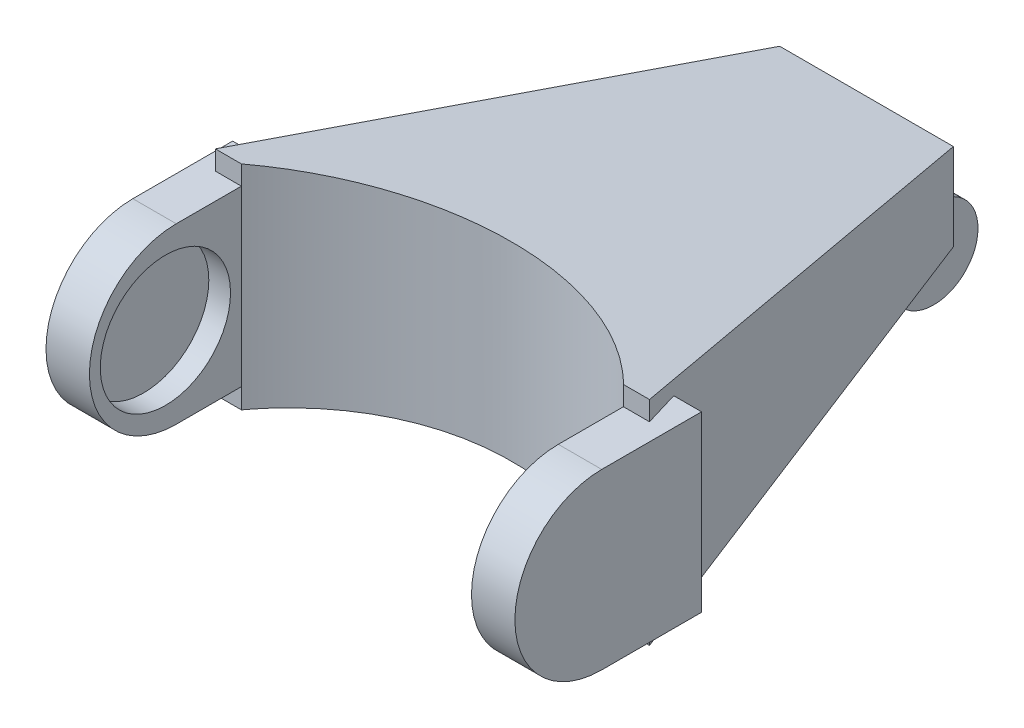
from build123d import *

# Parameters (mm, degrees)
BOSS_EXTRUDE1_DEPTH = 30
CUT_EXTRUDE2_DEPTH  = 50
CUT_EXTRUDE6_DEPTH  = 27
SHELL3_T            = 5
BOSS_EXTRUDE3_DEPTH = 20
BOSS_EXTRUDE4_START = -3
BOSS_EXTRUDE4_DEPTH = 5
SKETCH7_R           = 7.5
CUT_EXTRUDE3_DEPTH  = 2.5


with BuildPart() as part:
    # Sketch1 → Boss-Extrude1 (new body)
    with BuildSketch(Plane(origin=(0, 0, 0), x_dir=(1, 0, 0), z_dir=(0, 1, 0))):
        Polygon((-10, 60), (10, 60), (25, 10), (-25, 10), align=None)
    extrude(amount=BOSS_EXTRUDE1_DEPTH)

    # Sketch3 → Cut-Extrude2 (cut)
    with BuildSketch(Plane(origin=(-25, 0, 0), x_dir=(0, -1, 0), z_dir=(-1, 0, 0))):
        Polygon((-30, -10), (-27.26731497, -10), (-20, -60), (-30, -60), align=None)
        Polygon((0, -60), (0, -10), (-2.73268503, -10), (-10, -60), align=None)
    extrude(amount=-CUT_EXTRUDE2_DEPTH, mode=Mode.SUBTRACT)

    # Sketch10 → Cut-Extrude6 (cut)
    with BuildSketch(Plane(origin=(0, 27.26731497, 0), x_dir=(-1, 0, 0), z_dir=(0, 1, 0))):
        with BuildLine():
            Line((-22, -10), (22, -10))
            ThreePointArc((22, -10), (0, -19.112698372), (-22, -10))
        make_face()
    extrude(amount=-CUT_EXTRUDE6_DEPTH, mode=Mode.SUBTRACT)

    # Shell3 (no face opened: a closed hollow body)
    add(offset(amount=-SHELL3_T, mode=Mode.PRIVATE), mode=Mode.SUBTRACT)

    # Sketch5 → Boss-Extrude3 (add)
    with BuildSketch(Plane(origin=(-10, 0, 0), x_dir=(0, -1, 0), z_dir=(1, 0, 0))):
        with BuildLine():
            Line((-10, 60), (-8.960811725, 52.850259833))
            ThreePointArc((-8.960811725, 52.850259833), (-6.536467075, 61.023474826), (-15, 60))
            Line((-15, 60), (-10, 60))
        make_face()
    extrude(amount=BOSS_EXTRUDE3_DEPTH)

    # Sketch6 → Boss-Extrude4 (add)
    with BuildSketch(Plane(origin=(-25, 0, 0), x_dir=(0, -1, 0), z_dir=(-1, 0, 0)).offset(BOSS_EXTRUDE4_START)):
        with BuildLine():
            Line((-25.046773104, -9.993090655), (-25.046773104, -13.993090655))
            Line((-25.046773104, -13.993090655), (-5.046773104, -13.993090655))
            Line((-5.046773104, -13.993090655), (-5.046773104, -9.993090655))
            Line((-5.046773104, -9.993090655), (-5.046773104, -2.5))
            ThreePointArc((-5.046773104, -2.5), (-15.046773104, 7.5), (-25.046773104, -2.5))
            Line((-25.046773104, -2.5), (-25.046773104, -9.993090655))
        make_face()
    boss_extrude4 = extrude(amount=BOSS_EXTRUDE4_DEPTH)

    # Sketch7 → Cut-Extrude3 (cut)
    with BuildSketch(Plane(origin=(-22, 0, 0), x_dir=(0, 0, -1), z_dir=(1, 0, 0))):
        with Locations((1.25, 15.046773104)):
            Circle(SKETCH7_R)
    cut_extrude3 = extrude(amount=-CUT_EXTRUDE3_DEPTH, mode=Mode.SUBTRACT)

    # Mirror2: Boss-Extrude4, Cut-Extrude3 across plane
    add(boss_extrude4.mirror(Plane.ZY))
    add(cut_extrude3.mirror(Plane.ZY), mode=Mode.SUBTRACT)


solid = part.part
